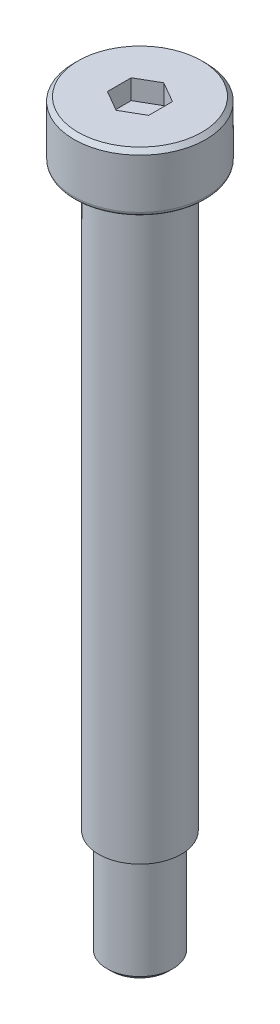
from build123d import *

# Parameters (mm, degrees)
CUT_EXTRUDE1_DEPTH = 2.4
CHAMFER1_SIZE      = 0.5
FILLET1_R          = 0.5
CHAMFER2_SIZE      = 0.5


with BuildPart() as part:
    # Sketch1 → Revolve1 (revolve)
    with BuildSketch(Plane.XY, mode=Mode.PRIVATE) as revolve1_sk:
        Polygon((0, 0), (8, 0), (8, -7), (4.75, -7), (4.75, -7.5), (5, -7.5), (5, -77), (4, -77), (4, -90), (0, -90), align=None)
    revolve(revolve1_sk.sketch.rotate(Axis((0, 5, 0), (0, -1, 0)), 180), axis=Axis((0, 5, 0), (0, -1, 0)))

    # Sketch2 → Cut-Extrude1 (cut)
    with BuildSketch(Plane(origin=(0, 0, 0), x_dir=(1, 0, 0), z_dir=(0, 1, 0))):
        Polygon((0, -2.886751346), (2.5, -1.443375673), (2.5, 1.443375673), (0, 2.886751346), (-2.5, 1.443375673), (-2.5, -1.443375673), align=None)
    extrude(amount=-CUT_EXTRUDE1_DEPTH, mode=Mode.SUBTRACT)

    # Chamfer1
    chamfer1_edges = [part.edges().sort_by_distance(p)[0] for p in [
        (8, 0, 0),
    ]]
    chamfer(chamfer1_edges, length=CHAMFER1_SIZE)

    # Fillet1
    fillet1_edges = [part.edges().sort_by_distance(p)[0] for p in [
        (8, -7, 0),
    ]]
    fillet(fillet1_edges, radius=FILLET1_R)

    # Chamfer2
    chamfer2_edges = [part.edges().sort_by_distance(p)[0] for p in [
        (4, -90, 0),
    ]]
    chamfer(chamfer2_edges, length=CHAMFER2_SIZE)


solid = part.part
